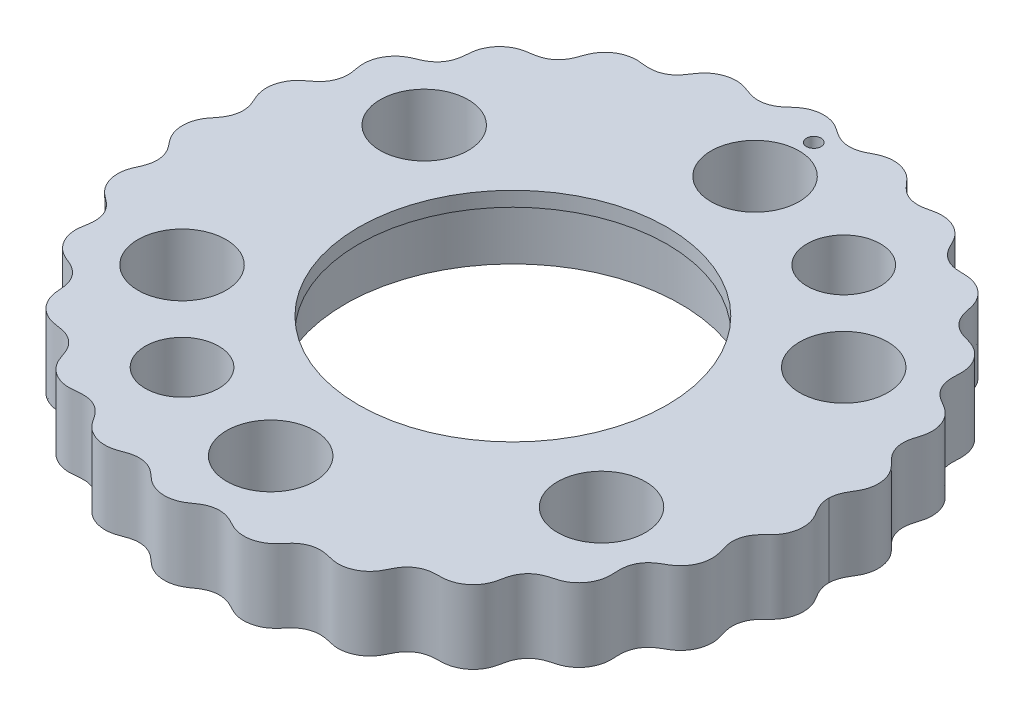
from build123d import *

# Parameters (mm, degrees)
BOSS_EXTRUDE1_DEPTH = 5
SKETCH2_R           = 11.425
CUT_EXTRUDE1_DEPTH  = 5
SKETCH3_R           = 3
CUT_EXTRUDE2_DEPTH  = 5
CIRPATTERN1_COUNT   = 6
SKETCH5_R           = 2.5
CUT_EXTRUDE3_DEPTH  = 5
CIRPATTERN2_COUNT   = 2
SKETCH6_R           = 12.451216954
SKETCH6_R_2         = 10.5
BOSS_EXTRUDE2_DEPTH = 1
SKETCH7_R           = 0.5
CUT_EXTRUDE4_DEPTH  = 5


with BuildPart() as part:
    # Sketch1 → Boss-Extrude1 (new body)
    with BuildSketch(Plane(origin=(0, 0, 0), x_dir=(1, 0, 0), z_dir=(0, 1, 0))):
        with BuildLine():
            add(Edge.make_bspline(
                [(21.5, 0), (21.5, -0.022795648), (21.501029798, -0.067704723), (21.505664016, -0.163287209), (21.517971578, -0.26706608), (21.536306326, -0.371602284), (21.560512677, -0.476256498), (21.597844303, -0.604628879), (21.648832285, -0.742870008), (21.715471931, -0.88939095), (21.798303927, -1.042889143), (21.880905824, -1.181287951), (21.965634084, -1.318335744), (22.047743353, -1.457058781), (22.141568148, -1.635443324), (22.286254031, -1.981582502), (22.368421524, -2.421033858), (22.335811077, -2.934910183), (22.174145209, -3.419701894), (21.99095847, -3.749480386), (21.771971642, -4.023287517), (21.538963332, -4.247536075), (21.287578906, -4.490419955), (21.052310467, -4.786004888), (20.86628673, -5.14590219), (20.761450474, -5.564770662), (20.755735036, -5.968942065), (20.822508646, -6.33892296), (20.926642695, -6.670776317), (21.020849566, -6.978393405), (21.078180272, -7.322549411), (21.07746081, -7.697824683), (21.003081253, -8.093784755), (20.843555833, -8.492539022), (20.623320583, -8.831594486), (20.362510139, -9.105298429), (20.080844855, -9.315588837), (19.798436738, -9.474596917), (19.494129238, -9.64843046), (19.193042299, -9.878112973), (18.922392637, -10.184987884), (18.716598269, -10.57271997), (18.614737076, -10.967683861), (18.592455277, -11.342616983), (18.611533827, -11.683028301), (18.624118313, -11.991107125), (18.595106734, -12.331071898), (18.502842362, -12.693216528), (18.332373701, -13.060611077), (18.07506318, -13.411620433), (17.774315371, -13.686679911), (17.45226868, -13.886415414), (17.125969418, -14.019230522), (16.812052534, -14.10255859), (16.473441864, -14.19622458), (16.124477284, -14.345719993), (15.780825809, -14.581977707), (15.478806711, -14.920833453), (15.28347244, -15.293586784), (15.174931043, -15.663684232), (15.111271631, -15.999784886), (15.043162779, -16.292876076), (14.927308659, -16.603267876), (14.748557662, -16.917576626), (14.495569598, -17.220812425), (14.163796574, -17.490305612), (13.806621751, -17.679399775), (13.443827203, -17.791931371), (13.093811397, -17.838332699), (12.768326214, -17.84035428), (12.416218343, -17.847687856), (12.040347656, -17.907509571), (11.649083059, -18.053250928), (11.273805116, -18.308626347), (10.993969347, -18.622244194), (10.798612314, -18.953719647), (10.654007457, -19.262720966), (10.514614641, -19.528768994), (10.324875693, -19.799088995), (10.073180539, -20.057986893), (9.752841289, -20.287160796), (9.363541622, -20.46556076), (8.890919825, -20.57649638), (8.423854169, -20.577347209), (8.001081062, -20.472684128), (7.57883967, -20.372597395), (7.198227195, -20.339565738), (6.783114608, -20.385259833), (6.356838556, -20.542207313), (6.00963401, -20.777770328), (5.73968902, -21.050783987), (5.523491298, -21.313556792), (5.322168119, -21.535472055), (5.07092742, -21.748791531), (4.763134857, -21.935439316), (4.29408165, -22.115901487), (3.783055418, -22.1727341), (3.297088475, -22.104238721), (2.866674117, -21.933132883), (2.579725015, -21.77656141), (2.265356433, -21.613984902), (1.904213196, -21.487930325), (1.489492014, -21.43166374), (1.038183469, -21.480080885), (0.644348302, -21.624091729), (0.316735371, -21.822019344), (0.042681085, -22.022602977), (-0.207399968, -22.186150065), (-0.597604776, -22.374600245), (-1.057287769, -22.479745044), (-1.563801935, -22.471181397), (-2.0548083, -22.332884975), (-2.397195938, -22.162174798), (-2.683863792, -21.952135463), (-2.922921233, -21.728064998), (-3.188279446, -21.492612679), (-3.508432994, -21.281556117), (-3.897493454, -21.125958051), (-4.347012431, -21.063310642), (-4.763563312, -21.107046937), (-5.128740485, -21.218475955), (-5.443245943, -21.34434571), (-5.725817036, -21.439628514), (-6.047650464, -21.503033396), (-6.405616351, -21.516023092), (-6.902823494, -21.445697437), (-7.377363339, -21.246774053), (-7.769557412, -20.949554121), (-8.063173053, -20.588651874), (-8.239077219, -20.311455053), (-8.438723108, -20.017116066), (-8.698282208, -19.733587722), (-9.038192038, -19.487722925), (-9.45901837, -19.317802372), (-9.873174211, -19.258864262), (-10.253551651, -19.277412057), (-10.588658346, -19.321104209), (-10.885442225, -19.342148983), (-11.212077228, -19.322458845), (-11.560942235, -19.24512832), (-12.024362415, -19.052244368), (-12.433895401, -18.74040472), (-12.739135206, -18.353567785), (-12.932764824, -17.929380009), (-13.03396784, -17.61633628), (-13.155335503, -17.281109595), (-13.338197746, -16.941939529), (-13.60842197, -16.620421988), (-13.975336461, -16.353398259), (-14.362209434, -16.195580127), (-14.73457759, -16.120567373), (-15.069235266, -16.079702705), (-15.361090299, -16.025484945), (-15.671490101, -15.924358306), (-15.988873392, -15.762127945), (-16.38887568, -15.459109626), (-16.707032953, -15.054306911), (-16.905517751, -14.602434605), (-16.986060099, -14.142225311), (-17.00606609, -13.812939099), (-17.051601747, -13.348551502), (-17.205253358, -12.865282323), (-17.522142778, -12.422071438), (-17.947236195, -12.110008614), (-18.289238992, -11.946244216), (-18.602329975, -11.823879909), (-18.870601873, -11.69813388), (-19.144821884, -11.522520555), (-19.410516215, -11.286178284), (-19.716878667, -10.89842961), (-19.923557011, -10.431222541), (-20.0056077, -9.944334415), (-19.970308009, -9.47363097), (-19.903591545, -9.135070859), (-19.83440386, -8.668455805), (-19.870044656, -8.161827089), (-20.070594664, -7.659669711), (-20.402230458, -7.259132681), (-20.692867795, -7.017192803), (-20.965060867, -6.821236211), (-21.192500704, -6.632420304), (-21.413104702, -6.393941278), (-21.610286017, -6.099056667), (-21.809358495, -5.646969614), (-21.892108847, -5.142649073), (-21.8490157, -4.650092571), (-21.695886456, -4.202493127), (-21.546389968, -3.890661396), (-21.364214881, -3.454313727), (-21.2752362, -2.953572409), (-21.347779944, -2.417613532), (-21.571739533, -1.94863668), (-21.793616501, -1.643608799), (-22.007962526, -1.38669879), (-22.180138863, -1.147218268), (-22.333166654, -0.861550026), (-22.449530911, -0.527309468), (-22.529817024, -0.03256193), (-22.480655767, 0.480654905), (-22.311295657, 0.946245125), (-22.002770959, 1.406141242), (-21.706912708, 1.735221765), (-21.458927528, 2.140901932), (-21.317293845, 2.626299801), (-21.299292376, 3.079506214), (-21.381563669, 3.48702089), (-21.521510343, 3.835956348), (-21.664791087, 4.137603074), (-21.770864519, 4.41201509), (-21.846804342, 4.726329942), (-21.875244476, 5.078219246), (-21.828721188, 5.577142974), (-21.652165295, 6.061707092), (-21.370775746, 6.470366782), (-20.955394907, 6.838363024), (-20.586320994, 7.084299028), (-20.245940934, 7.418047432), (-19.990156362, 7.854878416), (-19.862619111, 8.290106394), (-19.843143505, 8.704841324), (-19.893083468, 9.076451436), (-19.956586036, 9.403584096), (-19.989983786, 9.695061487), (-19.98440046, 10.017868008), (-19.92336198, 10.364355079), (-19.777759505, 10.76859641), (-19.507474752, 11.197000284), (-19.143216247, 11.547990856), (-18.706972183, 11.788081108), (-18.292122029, 11.941450822), (-17.941129322, 12.11582572), (-17.615038978, 12.359203902), (-17.34070718, 12.67707834), (-17.113066507, 13.113027475), (-16.996377802, 13.660569401), (-17.005440062, 14.33064165), (-16.736351844, 15.061621091), (-16.291275669, 15.574383195), (-15.7979407, 15.878565793), (-15.396019325, 16.015951733), (-15.107915534, 16.074466171), (-14.777158659, 16.114872858), (-14.407998329, 16.182770941), (-14.019697585, 16.329957912), (-13.645572173, 16.586426943), (-13.309830789, 16.965010476), (-13.098331613, 17.39191391), (-12.978574811, 17.818587814), (-12.756675288, 18.326990835), (-12.391345751, 18.802667249), (-11.899751276, 19.139902225), (-11.346793463, 19.309760982), (-10.921462874, 19.341850779), (-10.627753819, 19.325657195), (-10.352771787, 19.289869825), (-10.092339832, 19.268899376), (-9.790034832, 19.272905369), (-9.453775673, 19.325894331), (-9.082581512, 19.463746877), (-8.665300534, 19.748942197), (-8.356770982, 20.110327011), (-8.135426756, 20.493177528), (-7.793138218, 20.928144818), (-7.402598313, 21.232663484), (-6.929586979, 21.437663869), (-6.434154237, 21.513854894), (-6.080084769, 21.506172865), (-5.760958736, 21.448581022), (-5.479899184, 21.358530085), (-5.169132807, 21.233963947), (-4.810101908, 21.117475578), (-4.294692157, 21.050129493), (-3.762734746, 21.147605566), (-3.314509588, 21.387517302), (-2.956302797, 21.695711591), (-2.70600699, 21.934036961), (-2.327591546, 22.217460753), (-1.872484404, 22.410222198), (-1.367263375, 22.487008273), (-0.875779743, 22.437035066), (-0.534230894, 22.340275407), (-0.239225417, 22.203808062), (0.010720095, 22.045517624), (0.281222998, 21.847088875), (0.601784201, 21.645581136), (1.085181931, 21.454681383), (1.713456872, 21.414221877), (2.285360203, 21.597169023), (2.760125969, 21.888661976), (3.277579761, 22.099810423), (3.765454926, 22.171888366), (4.273850966, 22.119309227), (4.737062589, 21.947446426), (5.04408436, 21.76739805), (5.295754923, 21.560509399), (5.498217892, 21.343909703), (5.711462572, 21.083791212), (5.973369428, 20.809204665), (6.402018612, 20.501933684), (6.92169077, 20.338358431), (7.428580823, 20.342284694), (7.883936963, 20.442761402), (8.203134168, 20.525328514), (8.665489831, 20.590471533), (9.156357978, 20.540961927), (9.639490391, 20.363153423), (10.051125909, 20.076048833), (10.303448351, 19.823952951), (10.495425551, 19.559644236), (10.637039356, 19.298544842), (10.779422473, 18.992700986), (10.966305296, 18.661698904), (11.236504618, 18.342817726), (11.604285591, 18.076967478), (11.993693004, 17.919974798), (12.372607378, 17.851383689), (12.728707497, 17.839818708), (13.057515712, 17.840177666), (13.520445793, 17.786707274), (13.982364407, 17.61563913), (14.405246258, 17.322253996), (14.731660436, 16.940851875), (14.912872437, 16.63260165), (15.032330958, 16.327726763), (15.103825003, 16.038725539), (15.165888644, 15.706306209), (15.266247465, 15.338661943), (15.450893874, 14.963136334), (15.743113965, 14.615883469), (16.082257098, 14.369189107), (16.432078184, 14.210483663), (16.773548248, 14.111876661), (17.091314365, 14.030157301), (17.524866144, 13.862137886), (17.928362199, 13.580767219), (18.263889796, 13.19073197), (18.484127648, 12.739385361), (18.582166474, 12.39461443), (18.621040518, 12.068688435), (18.617487077, 11.770320786), (18.594985514, 11.432088901), (18.602267128, 11.050092249), (18.690025466, 10.640408926), (18.889186047, 10.232567725), (19.157805249, 9.911149431), (19.457555227, 9.672411827), (19.763404911, 9.493133531), (20.050142981, 9.334985578), (20.33811948, 9.127112021), (20.605883534, 8.854183997), (20.888811866, 8.42978777), (21.05316971, 7.950543986), (21.09486257, 7.480656398), (21.035775061, 7.051085558), (20.957227182, 6.762591153), (20.851116448, 6.439737209), (20.764464973, 6.066648157), (20.749805425, 5.647420165), (20.843970725, 5.203399706), (21.026126326, 4.826745307), (21.257881444, 4.522752818), (21.509545026, 4.274285066), (21.747053848, 4.049888267), (21.972856644, 3.776758231), (22.162877466, 3.446006394), (22.330082414, 2.964312058), (22.368812081, 2.458965522), (22.290922429, 1.993012818), (22.125008195, 1.591272309), (21.994846135, 1.363621445), (21.87535488, 1.173803592), (21.785454267, 1.019247931), (21.722934411, 0.901788111), (21.669930674, 0.788754145), (21.625769679, 0.680889323), (21.587572888, 0.570986416), (21.555769125, 0.458203223), (21.533902396, 0.359533486), (21.519555583, 0.274358498), (21.510433274, 0.19799304), (21.504891178, 0.134991461), (21.502254666, 0.092809793), (21.501200425, 0.067795492), (21.500828924, 0.055385745)],
                knots=[0.073583191, 0.073583191, 0.073583191, 0.073583191, 0.073583191, 0.074192321, 0.074801452, 0.075410582, 0.076019713, 0.076628843, 0.077237974, 0.078456235, 0.079374265, 0.080292296, 0.081210327, 0.082128358, 0.083046388, 0.083964419, 0.08580048, 0.090658674, 0.093093486, 0.095528298, 0.097369166, 0.099210034, 0.101050902, 0.10289177, 0.105333314, 0.107774857, 0.110206348, 0.112637839, 0.114469102, 0.116300365, 0.118131628, 0.119962891, 0.122386266, 0.124809641, 0.127250159, 0.129690678, 0.131536006, 0.133381334, 0.135226662, 0.13707199, 0.139519251, 0.141966513, 0.144472125, 0.146977736, 0.148732632, 0.150487529, 0.152242425, 0.153997321, 0.156478942, 0.158960563, 0.161406779, 0.163852994, 0.165702442, 0.167551891, 0.169401339, 0.171250788, 0.173704446, 0.176158103, 0.178823023, 0.181487943, 0.183199446, 0.18491095, 0.186622453, 0.188333956, 0.190722631, 0.193111307, 0.195563206, 0.198015106, 0.199868692, 0.201722278, 0.203575864, 0.20542945, 0.207889465, 0.210349481, 0.213008107, 0.215666734, 0.217374121, 0.219081508, 0.220788895, 0.222496282, 0.224879167, 0.227262052, 0.229719623, 0.232177194, 0.235892672, 0.237750411, 0.23960815, 0.242074483, 0.244540816, 0.247193118, 0.24984542, 0.251548717, 0.253252014, 0.254955311, 0.256658608, 0.259035704, 0.261412799, 0.266339253, 0.268201159, 0.270063065, 0.27192497, 0.273786876, 0.276259486, 0.278732096, 0.281378044, 0.284023991, 0.285723226, 0.287422461, 0.289121696, 0.290820931, 0.295563546, 0.298032413, 0.300501279, 0.302367364, 0.304233449, 0.306099534, 0.307965619, 0.310444465, 0.312923311, 0.315562871, 0.318202432, 0.319897635, 0.321592839, 0.323288042, 0.324983246, 0.327348769, 0.329714291, 0.334663268, 0.336533543, 0.338403818, 0.340274094, 0.342144369, 0.344629408, 0.347114448, 0.34974759, 0.352380732, 0.354071936, 0.35576314, 0.357454345, 0.359145549, 0.361505292, 0.363865035, 0.368825527, 0.370699924, 0.372574322, 0.374448719, 0.376323117, 0.378814306, 0.381305495, 0.383932188, 0.38655888, 0.388246119, 0.389933358, 0.391620596, 0.393307835, 0.395661805, 0.398015776, 0.402987959, 0.404866432, 0.406744906, 0.408623379, 0.410501853, 0.415496442, 0.418116653, 0.420736865, 0.422420174, 0.424103483, 0.425786791, 0.4274701, 0.429818306, 0.432166513, 0.436981538, 0.438946723, 0.440911909, 0.442877094, 0.444842279, 0.449687094, 0.452300794, 0.454914494, 0.45659391, 0.458273326, 0.459952742, 0.461632159, 0.463974611, 0.466317063, 0.471143276, 0.473112811, 0.475082345, 0.47705188, 0.479021414, 0.483877624, 0.486484782, 0.489091939, 0.490767439, 0.49244294, 0.494118441, 0.495793941, 0.498130775, 0.500467609, 0.50547458, 0.50736532, 0.50925606, 0.51303754, 0.515552875, 0.518068209, 0.520668795, 0.52326938, 0.524940989, 0.526612598, 0.528284207, 0.529955817, 0.532287078, 0.534618339, 0.5396368, 0.541531637, 0.543426474, 0.547216149, 0.549737402, 0.552258655, 0.554852639, 0.557446623, 0.559114383, 0.560782143, 0.562449903, 0.564117664, 0.566443365, 0.568769067, 0.572171945, 0.575574824, 0.577799992, 0.58002516, 0.582250328, 0.584475496, 0.587001023, 0.58952655, 0.593322186, 0.597117822, 0.602144604, 0.606799037, 0.608467842, 0.610136648, 0.611805454, 0.613474259, 0.616070046, 0.618665834, 0.621185478, 0.623705121, 0.627492561, 0.62938628, 0.63128, 0.636295332, 0.640960892, 0.642633558, 0.644306225, 0.645978891, 0.647651557, 0.648952748, 0.650253938, 0.652856318, 0.655370031, 0.657883743, 0.661662989, 0.663552612, 0.665442235, 0.670446062, 0.672784418, 0.675122775, 0.676799344, 0.678475912, 0.680152481, 0.68182905, 0.684437995, 0.68704694, 0.69190005, 0.693868398, 0.695836746, 0.697805095, 0.699773443, 0.704596609, 0.70694063, 0.70928465, 0.710965124, 0.712645599, 0.714326073, 0.716006547, 0.718622026, 0.721237504, 0.726079198, 0.730007196, 0.731971196, 0.733935195, 0.738747161, 0.741096938, 0.743446716, 0.745131093, 0.74681547, 0.748499847, 0.750184224, 0.752806206, 0.755428189, 0.760419456, 0.762296817, 0.764174178, 0.766051539, 0.7679289, 0.772897899, 0.775253443, 0.777608987, 0.779297304, 0.780985621, 0.782673937, 0.784362254, 0.786990709, 0.789619164, 0.79210868, 0.794598196, 0.796471483, 0.798344771, 0.800218058, 0.802091345, 0.807048641, 0.809409959, 0.811771278, 0.81346357, 0.815155862, 0.816848153, 0.818540445, 0.821175341, 0.823810237, 0.826293591, 0.828776945, 0.830646077, 0.832515208, 0.83438434, 0.836253471, 0.841199385, 0.843566485, 0.845933585, 0.847629885, 0.849326185, 0.851022485, 0.852718785, 0.85536009, 0.858001396, 0.860478545, 0.862955695, 0.864820639, 0.866685582, 0.868550526, 0.87041547, 0.8728828, 0.875350131, 0.880095902, 0.881796242, 0.883496582, 0.885196922, 0.886897262, 0.889544946, 0.892192629, 0.894663532, 0.897134434, 0.898995202, 0.90085597, 0.902716738, 0.904577505, 0.907039192, 0.909500878, 0.914258227, 0.915962636, 0.917667046, 0.919371456, 0.920223661, 0.921075866, 0.921739373, 0.922402881, 0.923066388, 0.923729896, 0.924393403, 0.925056911, 0.925388665, 0.925720419, 0.926052172, 0.926383926, 0.926383926, 0.926383926, 0.926383926, 0.926383926], degree=4))
            Line((21.500828924, 0.055385745), (21.5, 0))
        make_face()
    extrude(amount=BOSS_EXTRUDE1_DEPTH)

    # Sketch2 → Cut-Extrude1 (cut)
    with BuildSketch(Plane(origin=(0, 5, 0), x_dir=(1, 0, 0), z_dir=(0, 1, 0))):
        with Locations(Location((0, 0, 0), (0, 0, 270))):
            Circle(SKETCH2_R)
    extrude(amount=-CUT_EXTRUDE1_DEPTH, mode=Mode.SUBTRACT)

    # Sketch3 → Cut-Extrude2 (cut)
    with BuildSketch(Plane(origin=(0, 5, 0), x_dir=(1, 0, 0), z_dir=(0, 1, 0))):
        with Locations(Location((0, 16.5, 0), (0, 0, 270))):
            Circle(SKETCH3_R)
    cut_extrude2 = extrude(amount=-CUT_EXTRUDE2_DEPTH, mode=Mode.SUBTRACT)

    # CirPattern1: Cut-Extrude2 ×6 about axis
    cirpattern1_axis = Axis((0, 0, 0), (0, 1, 0))
    for i in range(1, CIRPATTERN1_COUNT):
        add(cut_extrude2.rotate(cirpattern1_axis, i * 360 / CIRPATTERN1_COUNT), mode=Mode.SUBTRACT)

    # Sketch5 → Cut-Extrude3 (cut)
    with BuildSketch(Plane(origin=(0, 5, 0), x_dir=(1, 0, 0), z_dir=(0, 1, 0))):
        with Locations(Location((8.25, 14.289419162, 0), (0, 0, 270))):
            Circle(SKETCH5_R)
    cut_extrude3 = extrude(amount=-CUT_EXTRUDE3_DEPTH, mode=Mode.SUBTRACT)

    # CirPattern2: Cut-Extrude3 ×2 about axis
    cirpattern2_axis = Axis((0, 0, 0), (0, 1, 0))
    for i in range(1, CIRPATTERN2_COUNT):
        add(cut_extrude3.rotate(cirpattern2_axis, i * 360 / CIRPATTERN2_COUNT), mode=Mode.SUBTRACT)

    # Sketch6 → Boss-Extrude2 (add)
    with BuildSketch(Plane(origin=(0, 5, 0), x_dir=(1, 0, 0), z_dir=(0, 1, 0))):
        Circle(SKETCH6_R)
        with Locations(Location((0, 0, 0), (0, 0, 270))):
            Circle(SKETCH6_R_2, mode=Mode.SUBTRACT)
    extrude(amount=-BOSS_EXTRUDE2_DEPTH)

    # Sketch7 → Cut-Extrude4 (cut)
    with BuildSketch(Plane(origin=(0, 5, 0), x_dir=(1, 0, 0), z_dir=(0, 1, 0))):
        with Locations(Location((0, 20.5, 0), (0, 0, 270))):
            Circle(SKETCH7_R)
    extrude(amount=-CUT_EXTRUDE4_DEPTH, mode=Mode.SUBTRACT)


solid = part.part
